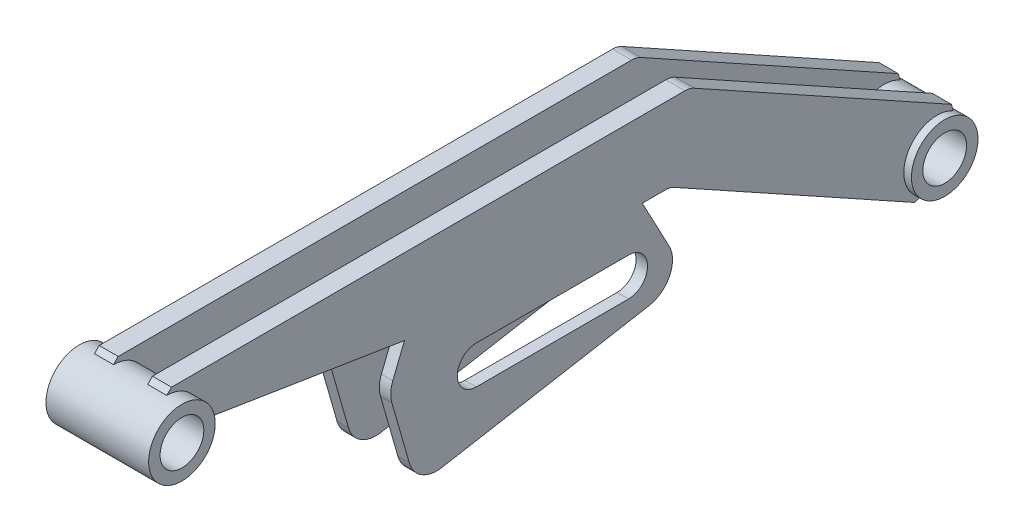
from build123d import *

# Parameters (mm, degrees)
DODANIE_WYCI_GNI_CIE1_DEPTH      = 10
DODANIE_WYCI_GNI_CIE2_DEPTH      = 8
DODANIE_WYCI_GNI_CIE2_DEPTH_BACK = 46
SZKIC2_R                         = 17.5
DODANIE_WYCI_GNI_CIE3_DEPTH      = 4
DODANIE_WYCI_GNI_CIE3_DEPTH_BACK = 42
SZKIC3_R                         = 17.5
WYTNIJ_WYCI_GNI_CIE1_REACH       = 440.128
SZKIC4_R                         = 11.5
WYTNIJ_WYCI_GNI_CIE2_REACH       = 439.653
SZKIC5_R                         = 11.5
ZAOKR_GLENIE2_R                  = 10
DODANIE_WYCI_GNI_CIE4_DEPTH      = 6
WYTNIJ_WYCI_GNI_CIE6_DEPTH       = 436.624710447
WYTNIJ_WYCI_GNI_CIE6_DEPTH_BACK  = 436.624710447


with BuildPart() as part:
    # Szkic1 → Dodanie-wyciągnięcie1 (new body)
    with BuildSketch(Plane(origin=(0, 0, 0), x_dir=(0, 0, -1), z_dir=(1, 0, 0))):
        Polygon((0, 0), (272.5, 0), (410.009643137, -76.222839853), (410.984168354, -79.621413171), (394.015831646, -110.233102921), (390.617258327, -111.207628138), (262.155296626, -40), (122.5, -40), (-2.5, -20), (-2.5, -2.5), align=None)
    extrude(amount=DODANIE_WYCI_GNI_CIE1_DEPTH)


with BuildPart() as body_2:
    # Lustro3: mirrored copy
    add(part.part.mirror(Plane.ZY.offset(9)))


with BuildPart() as part_1:
    add(part.part)

    add(body_2.part)  # Dodanie-wyciągnięcie2 merges body 2
    # Szkic2 → Dodanie-wyciągnięcie2 (add, two sides: drawn at the far end of the back side and taken through both)
    with BuildSketch(Plane(origin=(10, 0, 0), x_dir=(0, 0, -1), z_dir=(1, 0, 0)).offset(-DODANIE_WYCI_GNI_CIE2_DEPTH_BACK)):
        with Locations((-2.5, -20)):
            Circle(SZKIC2_R)
    extrude(amount=DODANIE_WYCI_GNI_CIE2_DEPTH + DODANIE_WYCI_GNI_CIE2_DEPTH_BACK)

    # Szkic3 → Dodanie-wyciągnięcie3 (add, two sides: drawn at the far end of the back side and taken through both)
    with BuildSketch(Plane(origin=(10, 0, 0), x_dir=(0, 0, -1), z_dir=(1, 0, 0)).offset(-DODANIE_WYCI_GNI_CIE3_DEPTH_BACK)):
        with Locations((402.5, -94.927258046)):
            Circle(SZKIC3_R)
    extrude(amount=DODANIE_WYCI_GNI_CIE3_DEPTH + DODANIE_WYCI_GNI_CIE3_DEPTH_BACK)

    # Szkic4 → Wytnij-wyciągnięcie1 (cut, up to next)
    with BuildSketch(Plane(origin=(18, 0, 0), x_dir=(0, 0, -1), z_dir=(1, 0, 0)), mode=Mode.PRIVATE) as wytnij_wyci_gni_cie1_sk1:
        with Locations((-2.5, -20)):
            Circle(SZKIC4_R)
    wytnij_wyci_gni_cie1_tool1 = extrude(wytnij_wyci_gni_cie1_sk1.sketch, amount=-WYTNIJ_WYCI_GNI_CIE1_REACH, mode=Mode.PRIVATE) & part_1.part
    add(wytnij_wyci_gni_cie1_tool1.solids().sort_by_distance((18, -20, 2.5))[0], mode=Mode.SUBTRACT)

    # Szkic5 → Wytnij-wyciągnięcie2 (cut, up to next)
    with BuildSketch(Plane(origin=(14, 0, 0), x_dir=(0, 0, -1), z_dir=(1, 0, 0)), mode=Mode.PRIVATE) as wytnij_wyci_gni_cie2_sk1:
        with Locations((402.5, -94.927258046)):
            Circle(SZKIC5_R)
    wytnij_wyci_gni_cie2_tool1 = extrude(wytnij_wyci_gni_cie2_sk1.sketch, amount=-WYTNIJ_WYCI_GNI_CIE2_REACH, mode=Mode.PRIVATE) & part_1.part
    add(wytnij_wyci_gni_cie2_tool1.solids().sort_by_distance((14, -94.927258, -402.5))[0], mode=Mode.SUBTRACT)

    # Zaokrąglenie2
    zaokr_glenie2_edges = [part_1.edges().sort_by_distance(p)[0] for p in [
        (5, 0, -272.5),
        (5, -40, -262.155296626),
        (-23, -40, -262.155296626),
        (-23, 0, -272.5),
    ]]
    fillet(zaokr_glenie2_edges, radius=ZAOKR_GLENIE2_R)


with BuildPart() as body_2_2:
    # Szkic6 → Dodanie-wyciągnięcie4 (new body)
    with BuildSketch(Plane.ZY.offset(28)):
        with BuildLine():
            Line((-122.5, -40), (-116.354286397, -55.211174944))
            ThreePointArc((-116.354286397, -55.211174944), (-115.282601194, -60.045234502), (-115.843118776, -64.964834183))
            Line((-115.843118776, -64.964834183), (-125.033969922, -97.01714122))
            ThreePointArc((-125.033969922, -97.01714122), (-131.504106398, -105.603302325), (-142.057618026, -107.654697178))
            Line((-142.057618026, -107.654697178), (-251.01872134, -88.441914816))
            ThreePointArc((-251.01872134, -88.441914816), (-261.89590937, -80.245365723), (-261.658212568, -66.627725079))
            Line((-261.658212568, -66.627725079), (-247.5, -40))
            Line((-247.5, -40), (-122.5, -40))
        make_face()
    dodanie_wyci_gni_cie4 = extrude(amount=-DODANIE_WYCI_GNI_CIE4_DEPTH)


with BuildPart() as part_2:
    add(part_1.part)

    # Lustro4: Dodanie-wyciągnięcie4 across plane
    add(dodanie_wyci_gni_cie4.mirror(Plane.ZY.offset(9)))


with BuildPart() as wytnij_wyci_gni_cie6_tool:
    # Szkic17 → Wytnij-wyciągnięcie6 (new, two sides: drawn at the far end of the back side and taken through both)
    with BuildSketch(Plane.ZY.offset(9).offset(-WYTNIJ_WYCI_GNI_CIE6_DEPTH_BACK)):
        with BuildLine():
            Line((-240.262044215, -60), (-160.262044215, -60))
            ThreePointArc((-160.262044215, -60), (-150.262044215, -70), (-160.262044215, -80))
            Line((-160.262044215, -80), (-240.262044215, -80))
            ThreePointArc((-240.262044215, -80), (-250.262044215, -70), (-240.262044215, -60))
        make_face()
    extrude(amount=WYTNIJ_WYCI_GNI_CIE6_DEPTH + WYTNIJ_WYCI_GNI_CIE6_DEPTH_BACK)


with BuildPart() as part_3:
    add(part_2.part)

    # Wytnij-wyciągnięcie6: cut by wytnij_wyci_gni_cie6_tool
    add(wytnij_wyci_gni_cie6_tool.part, mode=Mode.SUBTRACT)


with BuildPart() as body_2_2_1:
    add(body_2_2.part)

    # Wytnij-wyciągnięcie6: cut by wytnij_wyci_gni_cie6_tool
    add(wytnij_wyci_gni_cie6_tool.part, mode=Mode.SUBTRACT)


solid = Compound([part_3.part, body_2_2_1.part])
